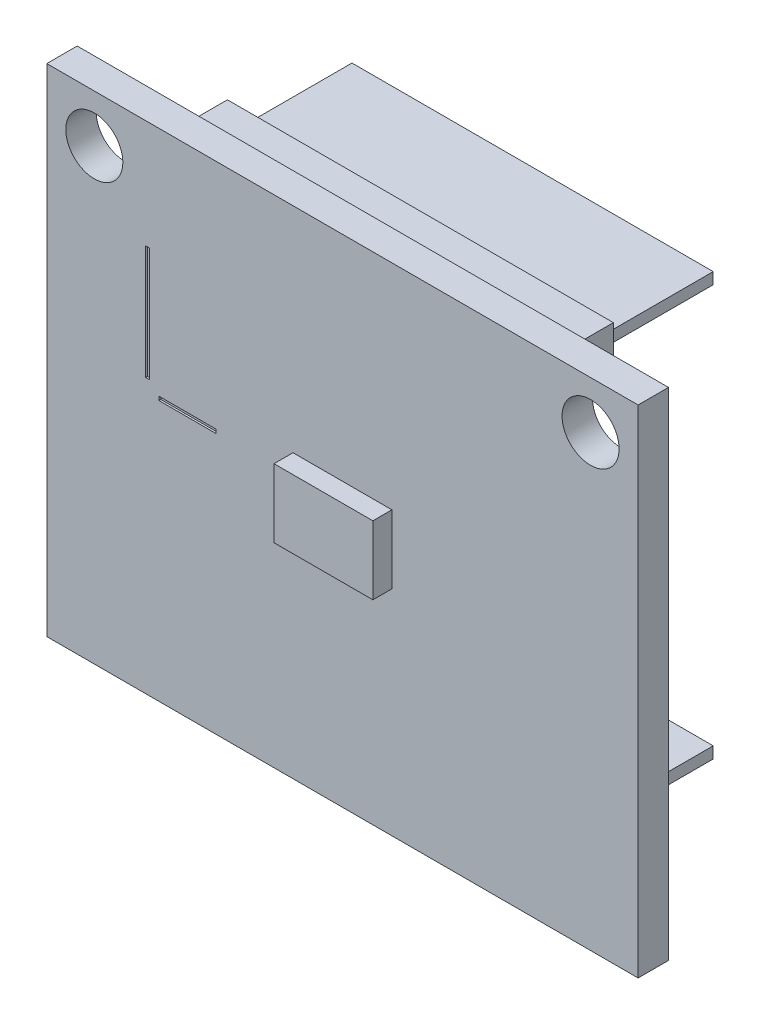
from build123d import *

# Parameters (mm, degrees)
SKETCH1_W           = 31.1
SKETCH1_H           = 26.1
BOSS_EXTRUDE1_DEPTH = 0.8
SKETCH2_W           = 20.3
SKETCH2_H           = 2.5
BOSS_EXTRUDE2_DEPTH = 2.5
SKETCH3_W           = 19
SKETCH3_H           = 0.6
BOSS_EXTRUDE3_DEPTH = 6.1
CHAMFER1_SIZE       = 0.2
SKETCH4_W           = 5.2
SKETCH4_H           = 3.6
BOSS_EXTRUDE4_DEPTH = 1
SKETCH5_W           = 0.2
SKETCH5_H           = 6
SKETCH5_W_2         = 3
SKETCH5_H_2         = 0.2
CUT_EXTRUDE1_DEPTH  = 0.1
SKETCH6_R           = 1.5
CUT_EXTRUDE2_DEPTH  = 23.718824794


with BuildPart() as part:
    # Sketch1 → Boss-Extrude1 (new, symmetric)
    with BuildSketch(Plane.XY):
        Rectangle(SKETCH1_W, SKETCH1_H)
    extrude(amount=BOSS_EXTRUDE1_DEPTH, both=True)

    # Sketch2 → Boss-Extrude2 (add)
    with BuildSketch(Plane(origin=(0, 0, -0.8), x_dir=(-1, 0, 0), z_dir=(0, 0, -1))):
        with Locations((0, -10.8)):
            Rectangle(SKETCH2_W, SKETCH2_H)
        with Locations((0, 10.8)):
            Rectangle(SKETCH2_W, SKETCH2_H)
    extrude(amount=BOSS_EXTRUDE2_DEPTH)

    # Sketch3 → Boss-Extrude3 (add)
    with BuildSketch(Plane(origin=(0, 0, -3.3), x_dir=(-1, 0, 0), z_dir=(0, 0, -1))):
        with Locations((0, 10.8)):
            Rectangle(SKETCH3_W, SKETCH3_H)
        with Locations((0, -10.8)):
            Rectangle(SKETCH3_W, SKETCH3_H)
    extrude(amount=BOSS_EXTRUDE3_DEPTH)

    # Chamfer1
    chamfer1_edges = [part.edges().sort_by_distance(p)[0] for p in [
        (9.5, 10.8, -9.4),
        (0, 10.5, -9.4),
        (-9.5, 10.8, -9.4),
        (0, 11.1, -9.4),
        (0, -11.1, -9.4),
        (-9.5, -10.8, -9.4),
        (0, -10.5, -9.4),
        (9.5, -10.8, -9.4),
    ]]
    chamfer(chamfer1_edges, length=CHAMFER1_SIZE)

    # Sketch4 → Boss-Extrude4 (add)
    with BuildSketch(Plane.XY.offset(0.8)):
        Rectangle(SKETCH4_W, SKETCH4_H)
    extrude(amount=BOSS_EXTRUDE4_DEPTH)

    # Sketch5 → Cut-Extrude1 (cut)
    with BuildSketch(Plane.XY.offset(0.8)):
        with Locations((-10.25, 4.35)):
            Rectangle(SKETCH5_W, SKETCH5_H)
        with Locations((-8.15, 0.75)):
            Rectangle(SKETCH5_W_2, SKETCH5_H_2)
    extrude(amount=-CUT_EXTRUDE1_DEPTH, mode=Mode.SUBTRACT)

    # Sketch6 → Cut-Extrude2 (cut, through all)
    with BuildSketch(Plane.XY.offset(0.8)):
        with Locations((-13.05, 10.55)):
            Circle(SKETCH6_R)
        with Locations((13.05, 10.55)):
            Circle(SKETCH6_R)
    extrude(amount=-CUT_EXTRUDE2_DEPTH, mode=Mode.SUBTRACT)


solid = part.part
